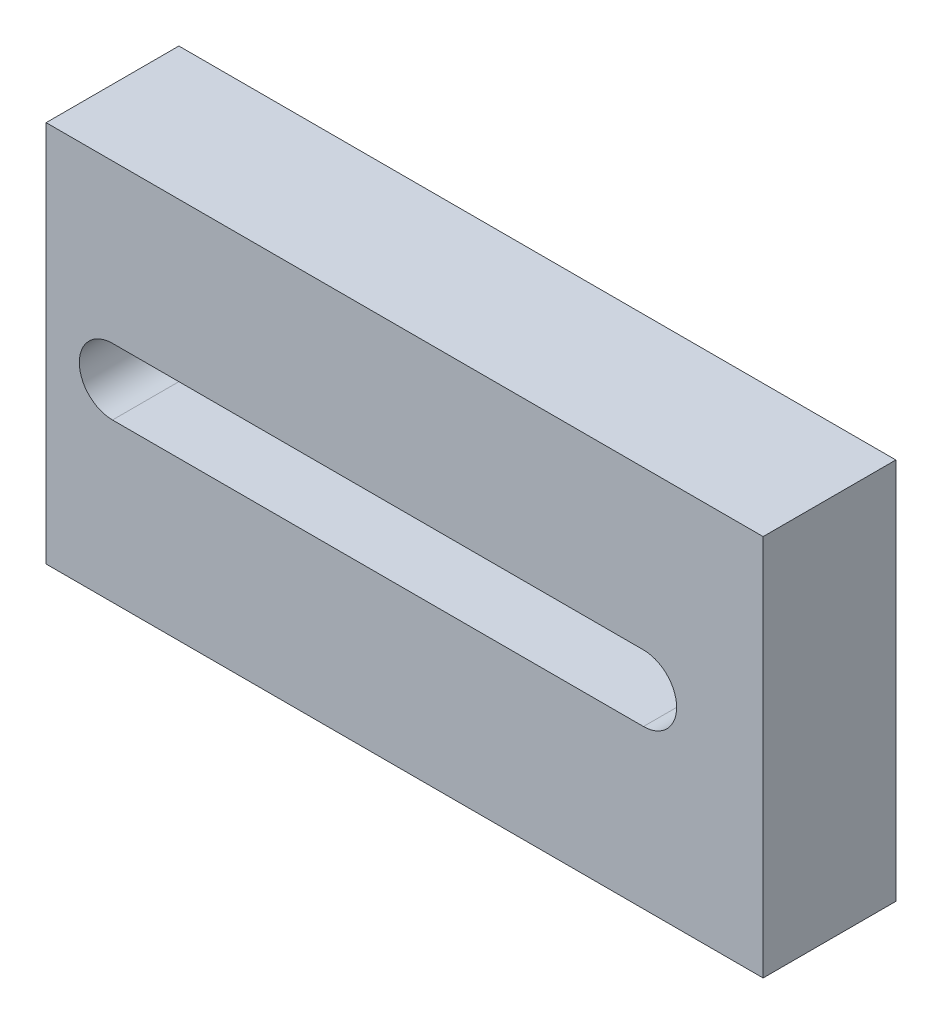
from build123d import *

# Parameters (mm, degrees)
BOSS_EXTRUDE1_DEPTH = 6.35


with BuildPart() as part:
    # Sketch1 → Boss-Extrude1 (new body)
    with BuildSketch(Plane.XY):
        Polygon((6576.963149331, 3585.75778924), (6611.263293087, 3585.75778924), (6611.263293087, 3567.469605114), (6576.963149331, 3567.46957805), align=None)
        with BuildLine():
            Line((6580.138149331, 3578.201183645), (6605.538149331, 3578.201183645))
            ThreePointArc((6605.538149331, 3578.201183645), (6607.125649331, 3576.613683645), (6605.538149331, 3575.026183645))
            Line((6605.538149331, 3575.026183645), (6580.138149331, 3575.026183645))
            ThreePointArc((6580.138149331, 3575.026183645), (6578.550649331, 3576.613683645), (6580.138149331, 3578.201183645))
        make_face(mode=Mode.SUBTRACT)
    extrude(amount=BOSS_EXTRUDE1_DEPTH)


solid = part.part
